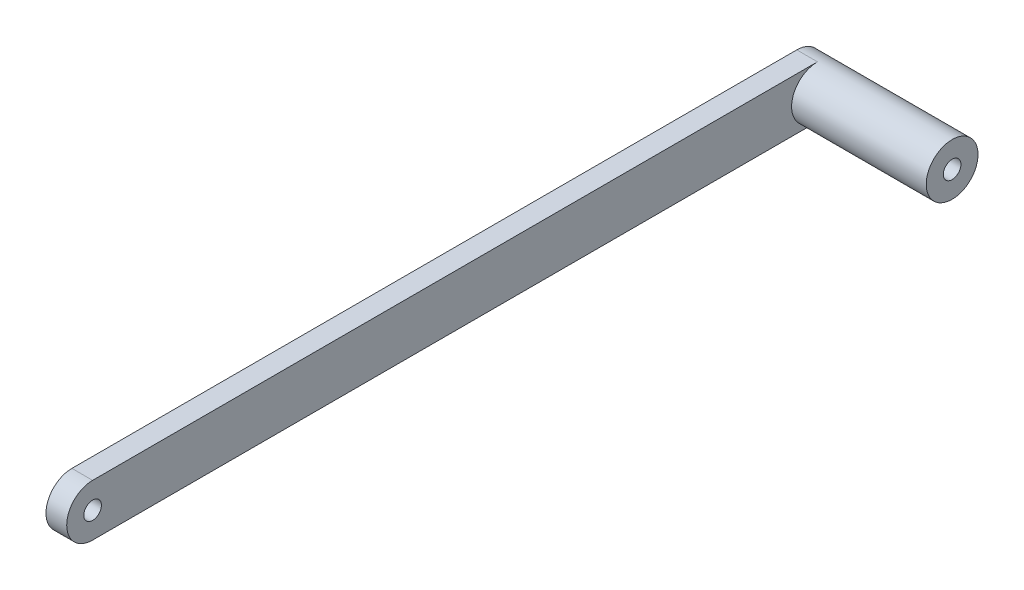
from build123d import *

# Parameters (mm, degrees)
RESSALTO_EXTRUS_O1_DEPTH = 2
ESBO_O2_R                = 2.5
RESSALTO_EXTRUS_O2_DEPTH = 13
CORTE_EXTRUS_O1_REACH    = 42.466
ESBO_O3_R                = 0.85
CORTE_EXTRUS_O2_REACH    = 41.768
ESBO_O4_R                = 0.85


with BuildPart() as part:
    # Esboço1 → Ressalto-extrusão1 (new body)
    with BuildSketch(Plane(origin=(0, 0, 0), x_dir=(0, 0, -1), z_dir=(1, 0, 0))):
        with BuildLine():
            Line((-35, 2.5), (35, 2.5))
            ThreePointArc((35, 2.5), (37.5, 0), (35, -2.5))
            Line((35, -2.5), (-35, -2.5))
            ThreePointArc((-35, -2.5), (-37.5, 0), (-35, 2.5))
        make_face()
    extrude(amount=RESSALTO_EXTRUS_O1_DEPTH)

    # Esboço2 → Ressalto-extrusão2 (add)
    with BuildSketch(Plane(origin=(2, 0, 0), x_dir=(0, 0, -1), z_dir=(1, 0, 0))):
        with Locations(Location((35, 0, 0), (0, 0, 90))):
            Circle(ESBO_O2_R)
    extrude(amount=RESSALTO_EXTRUS_O2_DEPTH)

    # Esboço3 → Corte-extrusão1 (cut, up to next)
    with BuildSketch(Plane(origin=(15, 0, 0), x_dir=(0, 0, -1), z_dir=(1, 0, 0)), mode=Mode.PRIVATE) as corte_extrus_o1_sk1:
        with Locations((35, 0)):
            Circle(ESBO_O3_R)
    corte_extrus_o1_tool1 = extrude(corte_extrus_o1_sk1.sketch, amount=-CORTE_EXTRUS_O1_REACH, mode=Mode.PRIVATE) & part.part
    add(corte_extrus_o1_tool1.solids().sort_by_distance((15, 0, -35))[0], mode=Mode.SUBTRACT)

    # Esboço4 → Corte-extrusão2 (cut, up to next)
    with BuildSketch(Plane(origin=(2, 0, 0), x_dir=(0, 0, -1), z_dir=(1, 0, 0)), mode=Mode.PRIVATE) as corte_extrus_o2_sk1:
        with Locations((-35, 0)):
            Circle(ESBO_O4_R)
    corte_extrus_o2_tool1 = extrude(corte_extrus_o2_sk1.sketch, amount=-CORTE_EXTRUS_O2_REACH, mode=Mode.PRIVATE) & part.part
    add(corte_extrus_o2_tool1.solids().sort_by_distance((2, 0, 35))[0], mode=Mode.SUBTRACT)


solid = part.part
